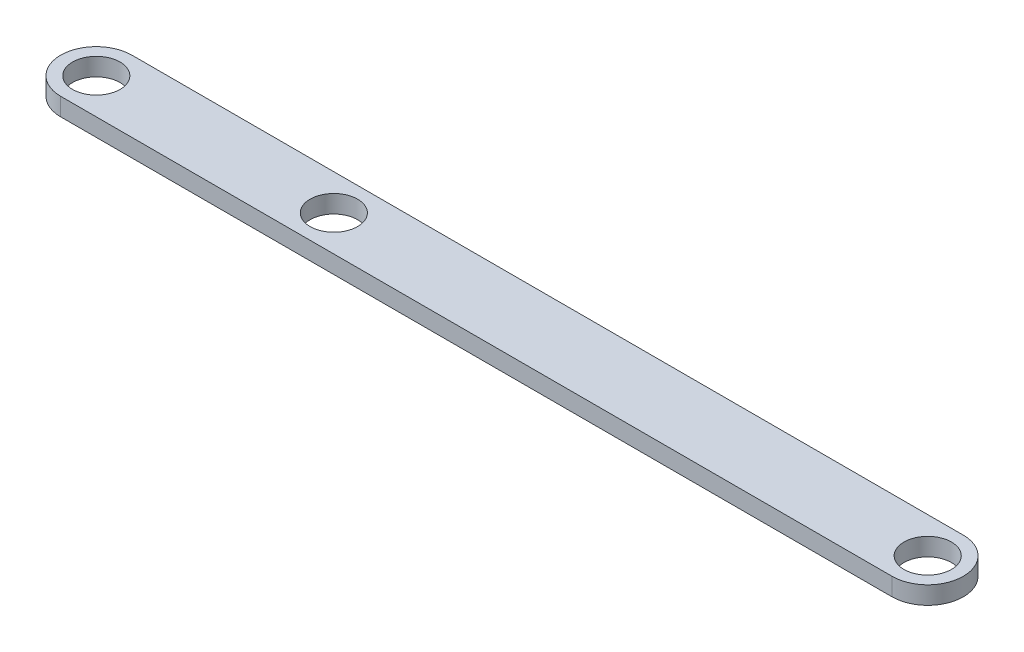
from build123d import *

# Parameters (mm, degrees)
SKETCH1_R           = 4
BOSS_EXTRUDE1_DEPTH = 3
SKETCH2_R           = 4
CUT_EXTRUDE1_DEPTH  = 147.15402834


with BuildPart() as part:
    # Sketch1 → Boss-Extrude1 (new body)
    with BuildSketch(Plane(origin=(0, 0, 0), x_dir=(1, 0, 0), z_dir=(0, 1, 0))):
        with BuildLine():
            Line((0, 6), (140, 6))
            ThreePointArc((140, 6), (146, 0), (140, -6))
            Line((140, -6), (0, -6))
            ThreePointArc((0, -6), (-6, 0), (0, 6))
        make_face()
        with Locations(Location((0, 0, 0), (0, 0, 270))):
            Circle(SKETCH1_R, mode=Mode.SUBTRACT)
        with Locations(Location((140, 0, 0), (0, 0, 270))):
            Circle(SKETCH1_R, mode=Mode.SUBTRACT)
    extrude(amount=BOSS_EXTRUDE1_DEPTH)

    # Sketch2 → Cut-Extrude1 (cut, through all)
    with BuildSketch(Plane(origin=(0, 3, 0), x_dir=(1, 0, 0), z_dir=(0, 1, 0))):
        with Locations(Location((40, 0, 0), (0, 0, 270))):
            Circle(SKETCH2_R)
    extrude(amount=-CUT_EXTRUDE1_DEPTH, mode=Mode.SUBTRACT)


solid = part.part
